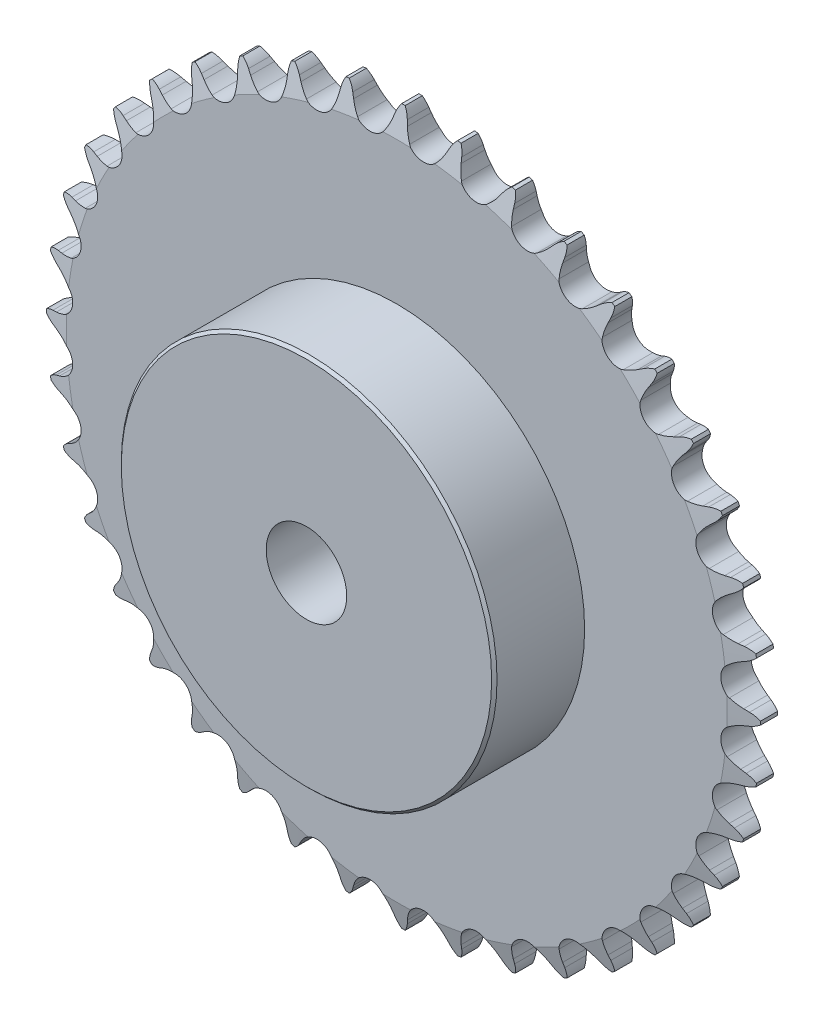
from build123d import *

# Parameters (mm, degrees)
CUT_EXTRUDE1_DEPTH      = 120.547548257
CIRPATTERN1_COUNT       = 40
BOSS_EXTRUDE1_START     = 3.6068
SKETCH2_R               = 44.45
BOSS_EXTRUDE1_DEPTH     = 21.3614
CUT_EXTRUDE2_DEPTH      = 123.073823292
CUT_EXTRUDE2_DEPTH_BACK = 123.073823292
SKETCH3_R               = 9.525
SKETCH4_W               = 5.4102
SKETCH4_H               = 10.541


with BuildPart() as part:
    # Sketch1 → Revolve1 (revolve)
    with BuildSketch(Plane(origin=(0, 0, 0), x_dir=(0, 0, -1), z_dir=(1, 0, 0)), mode=Mode.PRIVATE) as revolve1_sk:
        Polygon((3.6068, 0), (-3.6068, 0), (-3.6068, 78.144400075), (-2.0193, 84.494400075), (2.0193, 84.494400075), (3.6068, 78.144400075), align=None)
    revolve(revolve1_sk.sketch.rotate(Axis((0, 0, -3.6068), (0, 0, 1)), 90), axis=Axis((0, 0, -3.6068), (0, 0, 1)))

    # Sketch0 → Cut-Extrude1 (cut, symmetric)
    with BuildSketch(Plane.XY):
        with BuildLine():
            Line((11.468978269, -81.597558183), (11.000083165, -80.563884664))
            ThreePointArc((11.000083165, -80.563884664), (10.283441626, -79.246737512), (9.384167982, -78.046838088))
            ThreePointArc((9.384167982, -78.046838088), (6.034569956, -76.676481355), (2.940582062, -78.553959298))
            ThreePointArc((2.940582062, -78.553959298), (2.240085594, -79.879763361), (1.738314312, -81.292801681))
            Line((1.738314312, -81.292801681), (1.436894249, -82.387100318))
            ThreePointArc((1.436894249, -82.387100318), (-1.01067594, -85.896737151), (-5.12112317, -87.085170614))
            ThreePointArc((-5.12112317, -87.085170614), (6.844427612, -86.966698535), (18.681195724, -85.21188749))
            ThreePointArc((18.681195724, -85.21188749), (14.435442967, -84.681101229), (11.468978269, -81.597558183))
        make_face()
    cut_extrude1 = extrude(amount=CUT_EXTRUDE1_DEPTH, both=True, mode=Mode.SUBTRACT)

    # CirPattern1: Cut-Extrude1 ×40 about axis
    cirpattern1_axis = Axis((0, 0, 0), (0, 0, 1))
    for i in range(1, CIRPATTERN1_COUNT):
        add(cut_extrude1.rotate(cirpattern1_axis, i * 360 / CIRPATTERN1_COUNT), mode=Mode.SUBTRACT)

    # Sketch2 → Boss-Extrude1 (add)
    with BuildSketch(Plane.XY.offset(BOSS_EXTRUDE1_START)):
        Circle(SKETCH2_R)
    extrude(amount=BOSS_EXTRUDE1_DEPTH)

    # Sketch3 → Cut-Extrude2 (cut, two sides: drawn at the far end of the back side and taken through both)
    with BuildSketch(Plane.XY.offset(-CUT_EXTRUDE2_DEPTH_BACK)):
        Circle(SKETCH3_R)
    extrude(amount=CUT_EXTRUDE2_DEPTH + CUT_EXTRUDE2_DEPTH_BACK, mode=Mode.SUBTRACT)

    # Sketch4 → Cut-Revolve1 (revolve, cut)
    with BuildSketch(Plane(origin=(0, 0, 0), x_dir=(0, 0, -1), z_dir=(1, 0, 0))):
        Polygon((-24.9682, 44.45), (-24.9682, 43.815), (-24.3332, 44.45), align=None)
        with Locations((-6.3119, 79.223900075)):
            Rectangle(SKETCH4_W, SKETCH4_H)
    revolve(axis=Axis((0, 0, -3.6068), (0, 0, 1)), mode=Mode.SUBTRACT)


solid = part.part
